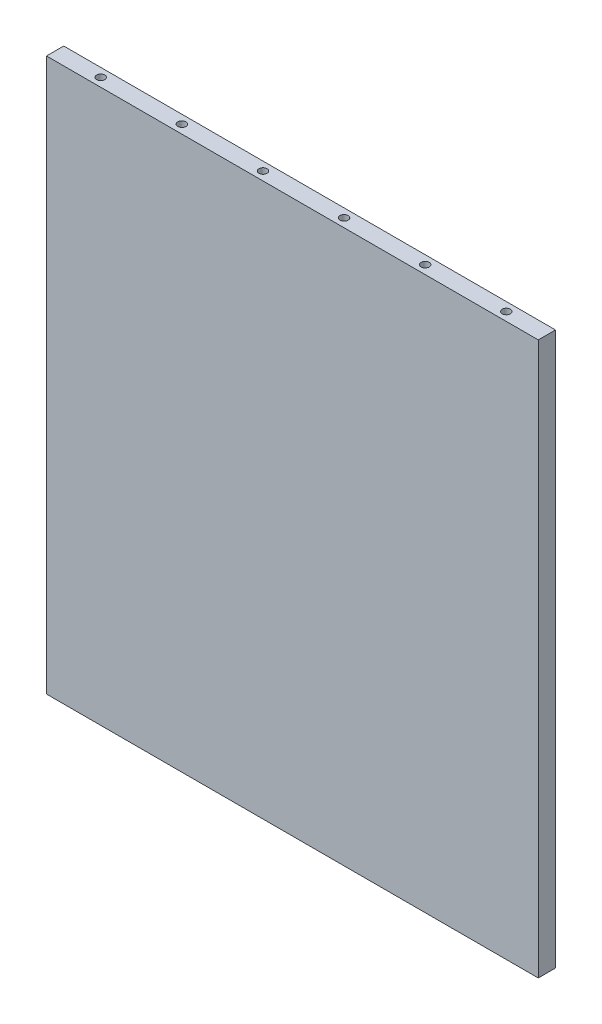
from build123d import *

# Parameters (mm, degrees)
SKETCH1_W               = 485
SKETCH1_H               = 545
BOSS_EXTRUDE1_DEPTH     = 17
CUT_EXTRUDE3_DEPTH      = 25
CUT_EXTRUDE3_DEPTH_BACK = 13
SKETCH4_R               = 4


with BuildPart() as part:
    # Sketch1 → Boss-Extrude1 (new body)
    with BuildSketch(Plane.XY):
        with Locations((12.5, -300.5)):
            Rectangle(SKETCH1_W, SKETCH1_H)
    extrude(amount=BOSS_EXTRUDE1_DEPTH)

    # Sketch4 → Cut-Extrude3 (cut, two sides: drawn at the far end of the back side and taken through both)
    with BuildSketch(Plane(origin=(5, -27.139504096, 249), x_dir=(0, 0, 1), z_dir=(0, -1, 0)).offset(-CUT_EXTRUDE3_DEPTH_BACK)):
        with Locations(Location((-240.5, -210, 0), (0, 0, 180))):
            Circle(SKETCH4_R)
        with Locations(Location((-240.5, -130, 0), (0, 0, 180))):
            Circle(SKETCH4_R)
        with Locations(Location((-240.5, -50, 0), (0, 0, 180))):
            Circle(SKETCH4_R)
        with Locations(Location((-240.5, 30, 0), (0, 0, 180))):
            Circle(SKETCH4_R)
        with Locations(Location((-240.5, 110, 0), (0, 0, 180))):
            Circle(SKETCH4_R)
        with Locations(Location((-240.5, 190, 0), (0, 0, 180))):
            Circle(SKETCH4_R)
    extrude(amount=CUT_EXTRUDE3_DEPTH + CUT_EXTRUDE3_DEPTH_BACK, mode=Mode.SUBTRACT)


solid = part.part
